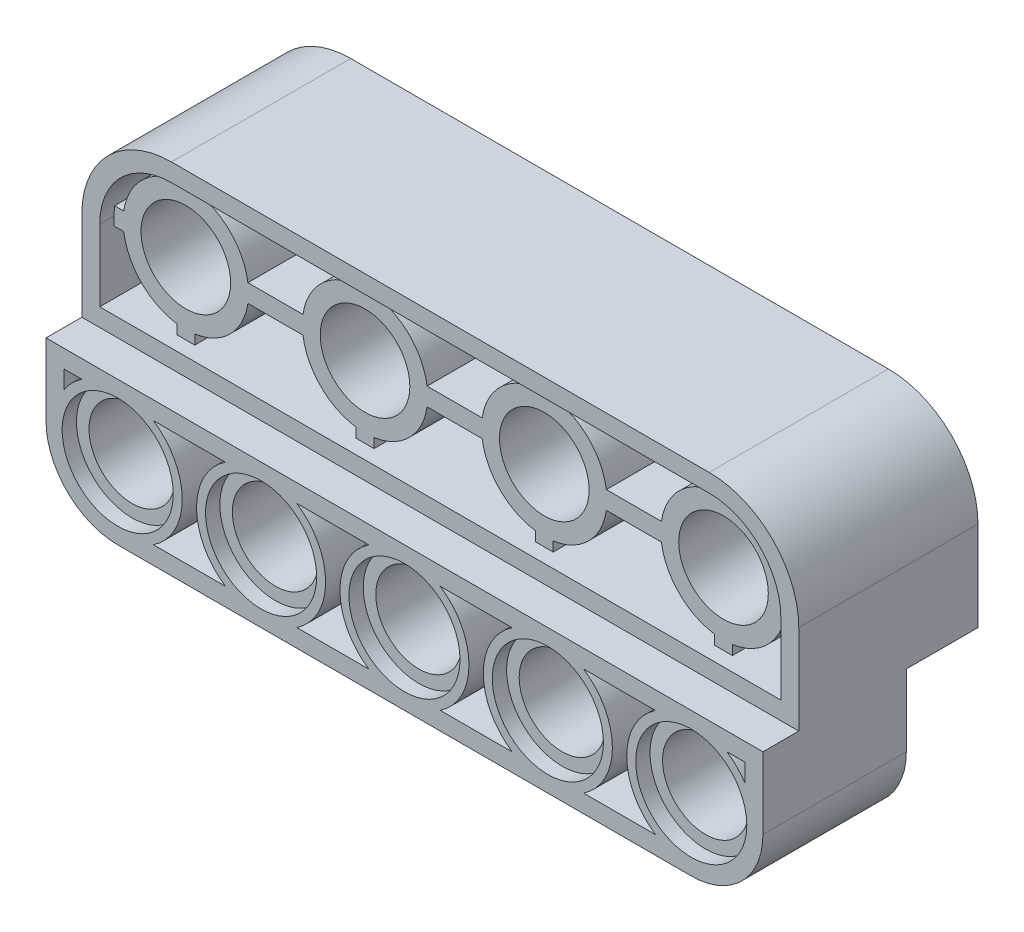
from build123d import *

# Parameters (mm, degrees)
SKETCH1_W           = 10
SKETCH1_H           = 10
SKETCH1_W_2         = 8
SKETCH1_H_2         = 8
BOSS_EXTRUDE1_DEPTH = 40
SKETCH2_R           = 2.5
CUT_EXTRUDE1_DEPTH  = 44.231932642
SKETCH3_R           = 2.4
CUT_EXTRUDE2_DEPTH  = 43.813549257
FILLET1_R           = 5
FILLET2_R           = 4
SKETCH4_R           = 3.1
CUT_EXTRUDE3_DEPTH  = 0.8
CUT_EXTRUDE4_START  = -0.8
SKETCH5_R           = 3.1
CUT_EXTRUDE4_DEPTH  = 0.8
SKETCH6_R           = 3.5
CUT_EXTRUDE5_DEPTH  = 0.8
CUT_EXTRUDE6_START  = -0.8
SKETCH7_R           = 3.5
CUT_EXTRUDE6_DEPTH  = 0.8
SKETCH8_R           = 3.5
CUT_EXTRUDE7_DEPTH  = 4.5
CUT_EXTRUDE8_START  = -4.5
SKETCH9_R           = 3.5
CUT_EXTRUDE8_DEPTH  = 4.5
CUT_EXTRUDE9_DEPTH  = 3.5
CUT_EXTRUDE10_START = -3.5
CUT_EXTRUDE10_DEPTH = 3.5
BOSS_EXTRUDE2_DEPTH = 3.7
BOSS_EXTRUDE3_START = -3.7
BOSS_EXTRUDE3_DEPTH = 3.7


with BuildPart() as part:
    # Sketch1 → Boss-Extrude1 (new body)
    with BuildSketch(Plane(origin=(0, 0, 0), x_dir=(0, 0, -1), z_dir=(1, 0, 0))):
        Rectangle(SKETCH1_W, SKETCH1_H)
        with Locations((-1, -9)):
            Rectangle(SKETCH1_W_2, SKETCH1_H_2)
    extrude(amount=BOSS_EXTRUDE1_DEPTH)

    # Sketch2 → Cut-Extrude1 (cut, through all)
    with BuildSketch(Plane(origin=(0, 0, -5), x_dir=(-1, 0, 0), z_dir=(0, 0, -1))):
        with Locations(Location((-35, 0, 0), (0, 0, 90))):
            Circle(SKETCH2_R)
        with Locations(Location((-25, 0, 0), (0, 0, 90))):
            Circle(SKETCH2_R)
        with Locations(Location((-15, 0, 0), (0, 0, 90))):
            Circle(SKETCH2_R)
        with Locations(Location((-5, 0, 0), (0, 0, 90))):
            Circle(SKETCH2_R)
    extrude(amount=-CUT_EXTRUDE1_DEPTH, mode=Mode.SUBTRACT)

    # Sketch3 → Cut-Extrude2 (cut, through all)
    with BuildSketch(Plane(origin=(0, 0, -3), x_dir=(-1, 0, 0), z_dir=(0, 0, -1))):
        with Locations((-36, -9)):
            Circle(SKETCH3_R)
        with Locations((-28, -9)):
            Circle(SKETCH3_R)
        with Locations((-20, -9)):
            Circle(SKETCH3_R)
        with Locations((-12, -9)):
            Circle(SKETCH3_R)
        with Locations((-4, -9)):
            Circle(SKETCH3_R)
    extrude(amount=-CUT_EXTRUDE2_DEPTH, mode=Mode.SUBTRACT)

    # Fillet1
    fillet1_edges = [part.edges().sort_by_distance(p)[0] for p in [
        (0, 5, 0),
        (40, 5, 0),
    ]]
    fillet(fillet1_edges, radius=FILLET1_R)

    # Fillet2
    fillet2_edges = [part.edges().sort_by_distance(p)[0] for p in [
        (40, -13, 1),
        (0, -13, 1),
    ]]
    fillet(fillet2_edges, radius=FILLET2_R)

    # Sketch4 → Cut-Extrude3 (cut)
    with BuildSketch(Plane(origin=(0, 0, -3), x_dir=(-1, 0, 0), z_dir=(0, 0, -1))):
        with Locations((-36, -9)):
            Circle(SKETCH4_R)
        with Locations((-28, -9)):
            Circle(SKETCH4_R)
        with Locations((-20, -9)):
            Circle(SKETCH4_R)
        with Locations((-12, -9)):
            Circle(SKETCH4_R)
        with Locations((-4, -9)):
            Circle(SKETCH4_R)
    extrude(amount=-CUT_EXTRUDE3_DEPTH, mode=Mode.SUBTRACT)

    # Sketch5 → Cut-Extrude4 (cut)
    with BuildSketch(Plane.XY.offset(5).offset(CUT_EXTRUDE4_START)):
        with Locations(Location((4, -9, 0), (0, 0, 180))):
            Circle(SKETCH5_R)
        with Locations(Location((12, -9, 0), (0, 0, 180))):
            Circle(SKETCH5_R)
        with Locations(Location((20, -9, 0), (0, 0, 180))):
            Circle(SKETCH5_R)
        with Locations(Location((28, -9, 0), (0, 0, 180))):
            Circle(SKETCH5_R)
        with Locations(Location((36, -9, 0), (0, 0, 180))):
            Circle(SKETCH5_R)
    extrude(amount=CUT_EXTRUDE4_DEPTH, mode=Mode.SUBTRACT)

    # Sketch6 → Cut-Extrude5 (cut)
    with BuildSketch(Plane(origin=(0, 0, -5), x_dir=(-1, 0, 0), z_dir=(0, 0, -1))):
        with Locations(Location((-25, 0, 0), (0, 0, 90))):
            Circle(SKETCH6_R)
        with Locations(Location((-35, 0, 0), (0, 0, 90))):
            Circle(SKETCH6_R)
        with Locations(Location((-15, 0, 0), (0, 0, 90))):
            Circle(SKETCH6_R)
        with Locations(Location((-5, 0, 0), (0, 0, 90))):
            Circle(SKETCH6_R)
    extrude(amount=-CUT_EXTRUDE5_DEPTH, mode=Mode.SUBTRACT)

    # Sketch7 → Cut-Extrude6 (cut)
    with BuildSketch(Plane.XY.offset(5).offset(CUT_EXTRUDE6_START)):
        with Locations(Location((5, 0, 0), (0, 0, 90))):
            Circle(SKETCH7_R)
        with Locations(Location((15, 0, 0), (0, 0, 90))):
            Circle(SKETCH7_R)
        with Locations(Location((35, 0, 0), (0, 0, 90))):
            Circle(SKETCH7_R)
        with Locations(Location((25, 0, 0), (0, 0, 90))):
            Circle(SKETCH7_R)
    extrude(amount=CUT_EXTRUDE6_DEPTH, mode=Mode.SUBTRACT)

    # Sketch8 → Cut-Extrude7 (cut)
    with BuildSketch(Plane(origin=(0, 0, -5), x_dir=(-1, 0, 0), z_dir=(0, 0, -1))):
        with BuildLine():
            Line((-1, -4), (-1, 0))
            ThreePointArc((-1, 0), (-2.171572875, 2.828427125), (-5, 4))
            Line((-5, 4), (-35, 4))
            ThreePointArc((-35, 4), (-37.828427125, 2.828427125), (-39, 0))
            Line((-39, 0), (-39, -4))
            Line((-39, -4), (-1, -4))
        make_face()
        with Locations(Location((-5, 0, 0), (0, 0, 180))):
            Circle(SKETCH8_R, mode=Mode.SUBTRACT)
        with Locations(Location((-15, 0, 0), (0, 0, 180))):
            Circle(SKETCH8_R, mode=Mode.SUBTRACT)
        with Locations(Location((-25, 0, 0), (0, 0, 180))):
            Circle(SKETCH8_R, mode=Mode.SUBTRACT)
        with Locations(Location((-35, 0, 0), (0, 0, 180))):
            Circle(SKETCH8_R, mode=Mode.SUBTRACT)
    extrude(amount=-CUT_EXTRUDE7_DEPTH, mode=Mode.SUBTRACT)

    # Sketch9 → Cut-Extrude8 (cut)
    with BuildSketch(Plane.XY.offset(5).offset(CUT_EXTRUDE8_START)):
        with BuildLine():
            Line((35, 4), (5, 4))
            ThreePointArc((5, 4), (2.171572875, 2.828427125), (1, 0))
            Line((1, 0), (1, -4))
            Line((1, -4), (39, -4))
            Line((39, -4), (39, 0))
            ThreePointArc((39, 0), (37.828427125, 2.828427125), (35, 4))
        make_face()
        with Locations(Location((25, 0, 0), (0, 0, 90))):
            Circle(SKETCH9_R, mode=Mode.SUBTRACT)
        with Locations(Location((15, 0, 0), (0, 0, 90))):
            Circle(SKETCH9_R, mode=Mode.SUBTRACT)
        with Locations(Location((35, 0, 0), (0, 0, 90))):
            Circle(SKETCH9_R, mode=Mode.SUBTRACT)
        with Locations(Location((5, 0, 0), (0, 0, 90))):
            Circle(SKETCH9_R, mode=Mode.SUBTRACT)
    extrude(amount=CUT_EXTRUDE8_DEPTH, mode=Mode.SUBTRACT)

    # Sketch10 → Cut-Extrude9 (cut)
    with BuildSketch(Plane(origin=(0, 0, -3), x_dir=(-1, 0, 0), z_dir=(0, 0, -1))):
        with BuildLine():
            ThreePointArc((-32.4, -9), (-32.827941556, -10.702364599), (-34.010025126, -12))
            Line((-34.010025126, -12), (-29.989974874, -12))
            ThreePointArc((-29.989974874, -12), (-31.6, -9), (-29.989974874, -6))
            Line((-29.989974874, -6), (-34.010025126, -6))
            ThreePointArc((-34.010025126, -6), (-32.827941556, -7.297635401), (-32.4, -9))
        make_face()
        with BuildLine():
            ThreePointArc((-24.4, -9), (-24.827941556, -10.702364599), (-26.010025126, -12))
            Line((-26.010025126, -12), (-21.989974874, -12))
            ThreePointArc((-21.989974874, -12), (-23.6, -9), (-21.989974874, -6))
            Line((-21.989974874, -6), (-26.010025126, -6))
            ThreePointArc((-26.010025126, -6), (-24.827941556, -7.297635401), (-24.4, -9))
        make_face()
        with BuildLine():
            ThreePointArc((-16.4, -9), (-16.827941556, -10.702364599), (-18.010025126, -12))
            Line((-18.010025126, -12), (-13.989974874, -12))
            ThreePointArc((-13.989974874, -12), (-15.6, -9), (-13.989974874, -6))
            Line((-13.989974874, -6), (-18.010025126, -6))
            ThreePointArc((-18.010025126, -6), (-16.827941556, -7.297635401), (-16.4, -9))
        make_face()
        with BuildLine():
            ThreePointArc((-8.4, -9), (-8.827941556, -10.702364599), (-10.010025126, -12))
            Line((-10.010025126, -12), (-5.989974874, -12))
            ThreePointArc((-5.989974874, -12), (-7.6, -9), (-5.989974874, -6))
            Line((-5.989974874, -6), (-10.010025126, -6))
            ThreePointArc((-10.010025126, -6), (-8.827941556, -7.297635401), (-8.4, -9))
        make_face()
        with BuildLine():
            Line((-39, -6), (-39, -7.010025126))
            ThreePointArc((-39, -7.010025126), (-38.545584412, -6.454415588), (-37.989974874, -6))
            Line((-37.989974874, -6), (-39, -6))
        make_face()
        with BuildLine():
            Line((-1, -7.010025126), (-1, -6))
            Line((-1, -6), (-2.010025126, -6))
            ThreePointArc((-2.010025126, -6), (-1.454415588, -6.454415588), (-1, -7.010025126))
        make_face()
    extrude(amount=-CUT_EXTRUDE9_DEPTH, mode=Mode.SUBTRACT)

    # Sketch11 → Cut-Extrude10 (cut)
    with BuildSketch(Plane.XY.offset(5).offset(CUT_EXTRUDE10_START)):
        with BuildLine():
            Line((10.010025126, -6), (5.989974874, -6))
            ThreePointArc((5.989974874, -6), (7.172058444, -7.297635401), (7.6, -9))
            ThreePointArc((7.6, -9), (7.172058444, -10.702364599), (5.989974874, -12))
            Line((5.989974874, -12), (10.010025126, -12))
            ThreePointArc((10.010025126, -12), (8.4, -9), (10.010025126, -6))
        make_face()
        with BuildLine():
            Line((18.010025126, -6), (13.989974874, -6))
            ThreePointArc((13.989974874, -6), (15.172058444, -7.297635401), (15.6, -9))
            ThreePointArc((15.6, -9), (15.172058444, -10.702364599), (13.989974874, -12))
            Line((13.989974874, -12), (18.010025126, -12))
            ThreePointArc((18.010025126, -12), (16.4, -9), (18.010025126, -6))
        make_face()
        with BuildLine():
            ThreePointArc((26.010025126, -12), (24.4, -9), (26.010025126, -6))
            Line((26.010025126, -6), (21.989974874, -6))
            ThreePointArc((21.989974874, -6), (23.172058444, -7.297635401), (23.6, -9))
            ThreePointArc((23.6, -9), (23.172058444, -10.702364599), (21.989974874, -12))
            Line((21.989974874, -12), (26.010025126, -12))
        make_face()
        with BuildLine():
            ThreePointArc((34.010025126, -12), (32.4, -9), (34.010025126, -6))
            Line((34.010025126, -6), (29.989974874, -6))
            ThreePointArc((29.989974874, -6), (31.172058444, -7.297635401), (31.6, -9))
            ThreePointArc((31.6, -9), (31.172058444, -10.702364599), (29.989974874, -12))
            Line((29.989974874, -12), (34.010025126, -12))
        make_face()
        with BuildLine():
            Line((39, -7.010025126), (39, -6))
            Line((39, -6), (37.989974874, -6))
            ThreePointArc((37.989974874, -6), (38.545584412, -6.454415588), (39, -7.010025126))
        make_face()
        with BuildLine():
            Line((2.010025126, -6), (1, -6))
            Line((1, -6), (1, -7.010025126))
            ThreePointArc((1, -7.010025126), (1.454415588, -6.454415588), (2.010025126, -6))
        make_face()
    extrude(amount=CUT_EXTRUDE10_DEPTH, mode=Mode.SUBTRACT)

    # Sketch12 → Boss-Extrude2 (add)
    with BuildSketch(Plane(origin=(0, 0, -4.2), x_dir=(-1, 0, 0), z_dir=(0, 0, -1))):
        with BuildLine():
            ThreePointArc((-31.5, 0), (-31.508986132, -0.250643519), (-31.535898385, -0.5))
            Line((-31.535898385, -0.5), (-28.464101615, -0.5))
            ThreePointArc((-28.464101615, -0.5), (-28.5, 0), (-28.464101615, 0.5))
            Line((-28.464101615, 0.5), (-31.535898385, 0.5))
            ThreePointArc((-31.535898385, 0.5), (-31.508986132, 0.250643519), (-31.5, 0))
        make_face()
        with BuildLine():
            ThreePointArc((-21.5, 0), (-21.508986132, -0.250643519), (-21.535898385, -0.5))
            Line((-21.535898385, -0.5), (-18.464101615, -0.5))
            ThreePointArc((-18.464101615, -0.5), (-18.5, 0), (-18.464101615, 0.5))
            Line((-18.464101615, 0.5), (-21.535898385, 0.5))
            ThreePointArc((-21.535898385, 0.5), (-21.508986132, 0.250643519), (-21.5, 0))
        make_face()
        with BuildLine():
            Line((-24.5, 4), (-25.5, 4))
            Line((-25.5, 4), (-25.5, 3.464101615))
            ThreePointArc((-25.5, 3.464101615), (-25, 3.5), (-24.5, 3.464101615))
            Line((-24.5, 3.464101615), (-24.5, 4))
        make_face()
        with BuildLine():
            Line((-35.5, 3.968626967), (-35.5, 3.464101615))
            ThreePointArc((-35.5, 3.464101615), (-35, 3.5), (-34.5, 3.464101615))
            Line((-34.5, 3.464101615), (-34.5, 4))
            Line((-34.5, 4), (-35, 4))
            ThreePointArc((-35, 4), (-35.25049165, 3.992149037), (-35.5, 3.968626967))
        make_face()
        with BuildLine():
            Line((-39, 0), (-39, -0.5))
            Line((-39, -0.5), (-38.464101615, -0.5))
            ThreePointArc((-38.464101615, -0.5), (-38.5, 0), (-38.464101615, 0.5))
            Line((-38.464101615, 0.5), (-38.968626967, 0.5))
            ThreePointArc((-38.968626967, 0.5), (-38.992149037, 0.25049165), (-39, 0))
        make_face()
        with BuildLine():
            Line((-25.5, -3.464101615), (-25.5, -4))
            Line((-25.5, -4), (-24.5, -4))
            Line((-24.5, -4), (-24.5, -3.464101615))
            ThreePointArc((-24.5, -3.464101615), (-25, -3.5), (-25.5, -3.464101615))
        make_face()
        with BuildLine():
            ThreePointArc((-34.5, -3.464101615), (-35, -3.5), (-35.5, -3.464101615))
            Line((-35.5, -3.464101615), (-35.5, -4))
            Line((-35.5, -4), (-34.5, -4))
            Line((-34.5, -4), (-34.5, -3.464101615))
        make_face()
        with BuildLine():
            Line((-15.5, -3.464101615), (-15.5, -4))
            Line((-15.5, -4), (-14.5, -4))
            Line((-14.5, -4), (-14.5, -3.464101615))
            ThreePointArc((-14.5, -3.464101615), (-15, -3.5), (-15.5, -3.464101615))
        make_face()
        with BuildLine():
            Line((-14.5, 4), (-15.5, 4))
            Line((-15.5, 4), (-15.5, 3.464101615))
            ThreePointArc((-15.5, 3.464101615), (-15, 3.5), (-14.5, 3.464101615))
            Line((-14.5, 3.464101615), (-14.5, 4))
        make_face()
        with BuildLine():
            ThreePointArc((-11.5, 0), (-11.508986132, -0.250643519), (-11.535898385, -0.5))
            Line((-11.535898385, -0.5), (-8.464101615, -0.5))
            ThreePointArc((-8.464101615, -0.5), (-8.5, 0), (-8.464101615, 0.5))
            Line((-8.464101615, 0.5), (-11.535898385, 0.5))
            ThreePointArc((-11.535898385, 0.5), (-11.508986132, 0.250643519), (-11.5, 0))
        make_face()
        with BuildLine():
            Line((-5, 4), (-5.5, 4))
            Line((-5.5, 4), (-5.5, 3.464101615))
            ThreePointArc((-5.5, 3.464101615), (-5, 3.5), (-4.5, 3.464101615))
            Line((-4.5, 3.464101615), (-4.5, 3.968626967))
            ThreePointArc((-4.5, 3.968626967), (-4.74950835, 3.992149037), (-5, 4))
        make_face()
        with BuildLine():
            Line((-5.5, -3.464101615), (-5.5, -4))
            Line((-5.5, -4), (-4.5, -4))
            Line((-4.5, -4), (-4.5, -3.464101615))
            ThreePointArc((-4.5, -3.464101615), (-5, -3.5), (-5.5, -3.464101615))
        make_face()
        with BuildLine():
            Line((-1.535898385, -0.5), (-1, -0.5))
            Line((-1, -0.5), (-1, 0))
            ThreePointArc((-1, 0), (-1.007850963, 0.25049165), (-1.031373033, 0.5))
            Line((-1.031373033, 0.5), (-1.535898385, 0.5))
            ThreePointArc((-1.535898385, 0.5), (-1.508986132, 0.250643519), (-1.5, 0))
            ThreePointArc((-1.5, 0), (-1.508986132, -0.250643519), (-1.535898385, -0.5))
        make_face()
    extrude(amount=-BOSS_EXTRUDE2_DEPTH)

    # Sketch13 → Boss-Extrude3 (add)
    with BuildSketch(Plane.XY.offset(4.2).offset(BOSS_EXTRUDE3_START)):
        with BuildLine():
            Line((15.5, 3.464101615), (15.5, 4))
            Line((15.5, 4), (14.5, 4))
            Line((14.5, 4), (14.5, 3.464101615))
            ThreePointArc((14.5, 3.464101615), (15, 3.5), (15.5, 3.464101615))
        make_face()
        with BuildLine():
            Line((5.5, 3.464101615), (5.5, 4))
            Line((5.5, 4), (5, 4))
            ThreePointArc((5, 4), (4.74950835, 3.992149037), (4.5, 3.968626967))
            Line((4.5, 3.968626967), (4.5, 3.464101615))
            ThreePointArc((4.5, 3.464101615), (5, 3.5), (5.5, 3.464101615))
        make_face()
        with BuildLine():
            Line((1, 0), (1, -0.5))
            Line((1, -0.5), (1.535898385, -0.5))
            ThreePointArc((1.535898385, -0.5), (1.5, 0), (1.535898385, 0.5))
            Line((1.535898385, 0.5), (1.031373033, 0.5))
            ThreePointArc((1.031373033, 0.5), (1.007850963, 0.25049165), (1, 0))
        make_face()
        with BuildLine():
            Line((4.5, -4), (5.5, -4))
            Line((5.5, -4), (5.5, -3.464101615))
            ThreePointArc((5.5, -3.464101615), (5, -3.5), (4.5, -3.464101615))
            Line((4.5, -3.464101615), (4.5, -4))
        make_face()
        with BuildLine():
            Line((8.464101615, -0.5), (11.535898385, -0.5))
            ThreePointArc((11.535898385, -0.5), (11.5, 0), (11.535898385, 0.5))
            Line((11.535898385, 0.5), (8.464101615, 0.5))
            ThreePointArc((8.464101615, 0.5), (8.491013868, 0.250643519), (8.5, 0))
            ThreePointArc((8.5, 0), (8.491013868, -0.250643519), (8.464101615, -0.5))
        make_face()
        with BuildLine():
            Line((14.5, -4), (15.5, -4))
            Line((15.5, -4), (15.5, -3.464101615))
            ThreePointArc((15.5, -3.464101615), (15, -3.5), (14.5, -3.464101615))
            Line((14.5, -3.464101615), (14.5, -4))
        make_face()
        with BuildLine():
            Line((18.464101615, -0.5), (21.535898385, -0.5))
            ThreePointArc((21.535898385, -0.5), (21.5, 0), (21.535898385, 0.5))
            Line((21.535898385, 0.5), (18.464101615, 0.5))
            ThreePointArc((18.464101615, 0.5), (18.491013868, 0.250643519), (18.5, 0))
            ThreePointArc((18.5, 0), (18.491013868, -0.250643519), (18.464101615, -0.5))
        make_face()
        with BuildLine():
            Line((25.5, 3.464101615), (25.5, 4))
            Line((25.5, 4), (24.5, 4))
            Line((24.5, 4), (24.5, 3.464101615))
            ThreePointArc((24.5, 3.464101615), (25, 3.5), (25.5, 3.464101615))
        make_face()
        with BuildLine():
            Line((28.464101615, -0.5), (31.535898385, -0.5))
            ThreePointArc((31.535898385, -0.5), (31.5, 0), (31.535898385, 0.5))
            Line((31.535898385, 0.5), (28.464101615, 0.5))
            ThreePointArc((28.464101615, 0.5), (28.491013868, 0.250643519), (28.5, 0))
            ThreePointArc((28.5, 0), (28.491013868, -0.250643519), (28.464101615, -0.5))
        make_face()
        with BuildLine():
            Line((24.5, -4), (25.5, -4))
            Line((25.5, -4), (25.5, -3.464101615))
            ThreePointArc((25.5, -3.464101615), (25, -3.5), (24.5, -3.464101615))
            Line((24.5, -3.464101615), (24.5, -4))
        make_face()
        with BuildLine():
            Line((35.5, 3.464101615), (35.5, 3.968626967))
            ThreePointArc((35.5, 3.968626967), (35.25049165, 3.992149037), (35, 4))
            Line((35, 4), (34.5, 4))
            Line((34.5, 4), (34.5, 3.464101615))
            ThreePointArc((34.5, 3.464101615), (35, 3.5), (35.5, 3.464101615))
        make_face()
        with BuildLine():
            Line((38.464101615, -0.5), (39, -0.5))
            Line((39, -0.5), (39, 0))
            ThreePointArc((39, 0), (38.992149037, 0.25049165), (38.968626967, 0.5))
            Line((38.968626967, 0.5), (38.464101615, 0.5))
            ThreePointArc((38.464101615, 0.5), (38.491013868, 0.250643519), (38.5, 0))
            ThreePointArc((38.5, 0), (38.491013868, -0.250643519), (38.464101615, -0.5))
        make_face()
        with BuildLine():
            Line((34.5, -4), (35.5, -4))
            Line((35.5, -4), (35.5, -3.464101615))
            ThreePointArc((35.5, -3.464101615), (35, -3.5), (34.5, -3.464101615))
            Line((34.5, -3.464101615), (34.5, -4))
        make_face()
    extrude(amount=BOSS_EXTRUDE3_DEPTH)


with BuildPart() as body_2:
    # Split1: the piece on the far side of the plane
    add(part.part)
    split(bisect_by=Plane(origin=(0, -5, 0), x_dir=(0, 0, -1), z_dir=(0, -1, 0)), keep=Keep.BOTTOM)


with BuildPart() as part_1:
    add(part.part)

    # Split1
    split(bisect_by=Plane(origin=(0, -5, 0), x_dir=(0, 0, -1), z_dir=(0, -1, 0)), keep=Keep.TOP)


with BuildPart() as body_2_1:
    # Body-Move/Copy1: moved
    add(body_2.part.moved(Location((0, 0, -2))))


with BuildPart() as part_2:
    add(part_1.part)

    # Combine1: union body 2
    add(body_2_1.part)


solid = part_2.part
